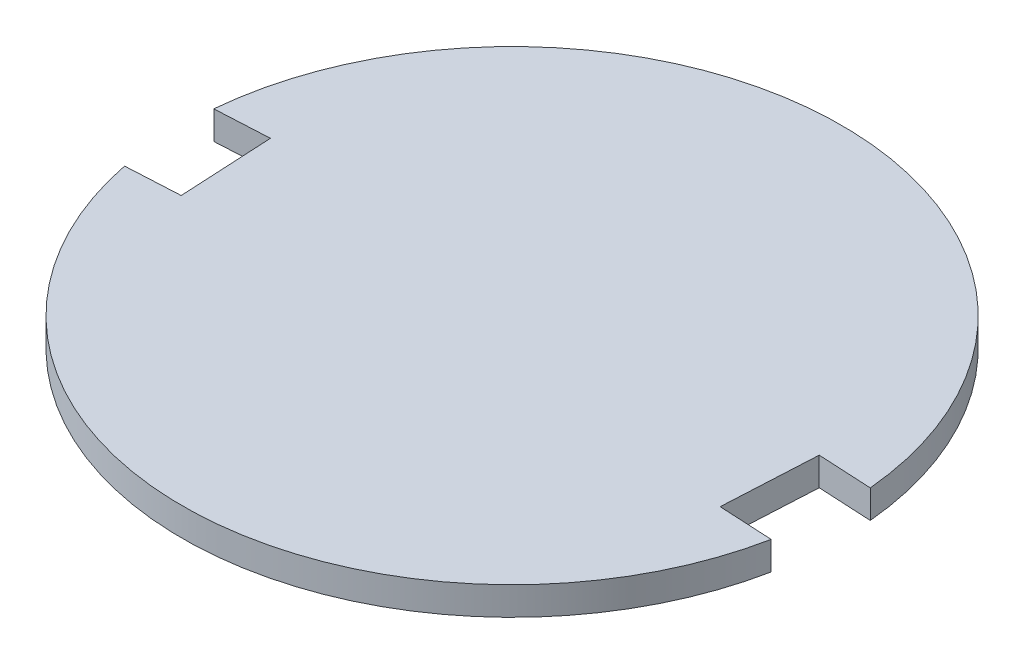
from build123d import *

# Parameters (mm, degrees)
EXTRUDE_1_DEPTH = 3


with BuildPart() as part:
    # Эскиз1 → Бобышка-Вытянуть1 (new body)
    with BuildSketch(Plane(origin=(0, 0, 0), x_dir=(1, 0, 0), z_dir=(0, 1, 0))):
        with BuildLine():
            Line((-32.059025738, 10.319816837), (-26.344543302, 10.619300172))
            Line((-26.344543302, 10.619300172), (-26.868621095, 20.619300172))
            Line((-26.868621095, 20.619300172), (-32.585084398, 20.319713025))
            ThreePointArc((-32.585084398, 20.319713025), (2.270137226, 52.139536056), (37.12535885, 20.319713025))
            Line((37.12535885, 20.319713025), (31.408895547, 20.619300172))
            Line((31.408895547, 20.619300172), (30.884817754, 10.619300172))
            Line((30.884817754, 10.619300172), (36.59930019, 10.319816837))
            ThreePointArc((36.59930019, 10.319816837), (2.270137226, -17.860463944), (-32.059025738, 10.319816837))
        make_face()
    extrude(amount=EXTRUDE_1_DEPTH)


solid = part.part
